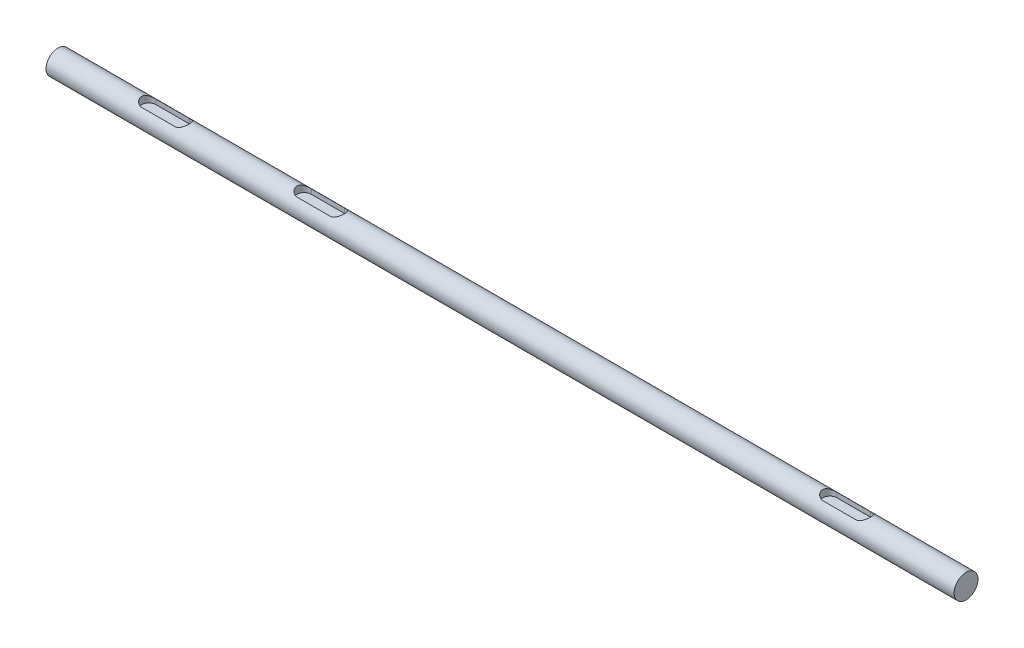
from build123d import *

# Parameters (mm, degrees)
SKETCH_1_R             = 5
EXTRUDE_1_DEPTH        = 150
CUT_EXTRUDE_1_DEPTH    = 3
SKETCH_3_R             = 5
EXTRUDE_2_DEPTH        = 150
CUT_EXTRUDE_2_DEPTH    = 3
EXTRUDE_START          = 80
SKETCH_5_R             = 5
EXTRUDE_4_DEPTH        = 80
PATTERN_LINEAR_2_COUNT = 2
PATTERN_LINEAR_2_PITCH = 65


with BuildPart() as part:
    # 草图1 → 凸台-拉伸1 (new body)
    with BuildSketch(Plane(origin=(0, 0, 0), x_dir=(0, 0, -1), z_dir=(1, 0, 0))):
        Circle(SKETCH_1_R)
    extrude(amount=EXTRUDE_1_DEPTH)

    # 草图2 → 切除-拉伸1 (cut)
    with BuildSketch(Plane(origin=(0, 5, 0), x_dir=(1, 0, 0), z_dir=(0, 1, 0))):
        with BuildLine():
            Line((23, 3), (37, 3))
            ThreePointArc((37, 3), (40, 0), (37, -3))
            Line((37, -3), (23, -3))
            ThreePointArc((23, -3), (20, 0), (23, 3))
        make_face()
    cut_extrude_1 = extrude(amount=-CUT_EXTRUDE_1_DEPTH, mode=Mode.SUBTRACT)

    # 草图3 → 凸台-拉伸2 (add)
    with BuildSketch(Plane(origin=(150, 0, 0), x_dir=(0, 0, -1), z_dir=(1, 0, 0))):
        Circle(SKETCH_3_R)
    extrude(amount=EXTRUDE_2_DEPTH)

    # 草图4 → 切除-拉伸2 (cut)
    with BuildSketch(Plane(origin=(0, 5, 0), x_dir=(1, 0, 0), z_dir=(0, 1, 0))):
        with BuildLine():
            Line((243, 3), (257, 3))
            ThreePointArc((257, 3), (260, 0), (257, -3))
            Line((257, -3), (243, -3))
            ThreePointArc((243, -3), (240, 0), (243, 3))
        make_face()
    extrude(amount=-CUT_EXTRUDE_2_DEPTH, mode=Mode.SUBTRACT)

    # 草图5 → 凸台-拉伸4 (add)
    with BuildSketch(Plane.ZY.offset(EXTRUDE_START)):
        Circle(SKETCH_5_R)
    extrude(amount=-EXTRUDE_4_DEPTH)

    # 阵列(线性)2: 切除-拉伸1 ×2
    with Locations(*[(-i * PATTERN_LINEAR_2_PITCH, 0, 0) for i in range(1, PATTERN_LINEAR_2_COUNT)]):
        add(cut_extrude_1, mode=Mode.SUBTRACT)


solid = part.part
